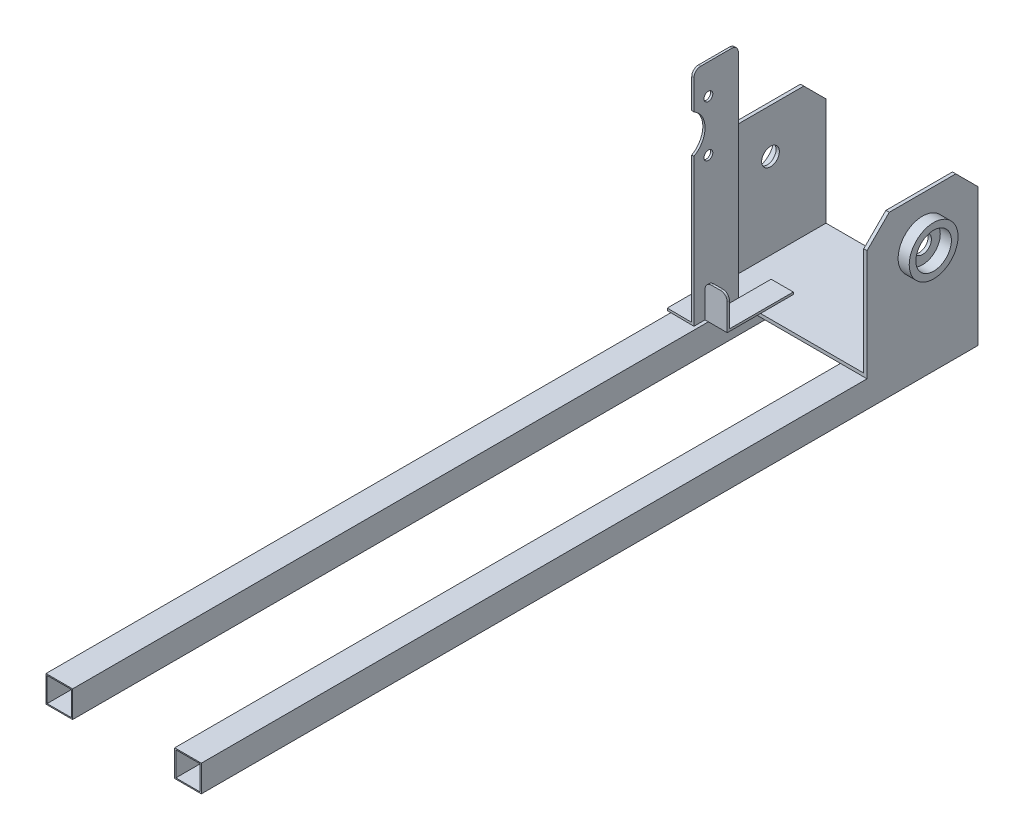
from build123d import *

# Parameters (mm, degrees)
BOSS_EXTRUDE1_DEPTH = 50
CHAMFER1_SIZE       = 10
SKETCH2_R           = 4
CUT_EXTRUDE1_DEPTH  = 80
SKETCH3_R           = 11
SKETCH3_R_2         = 8
BOSS_EXTRUDE2_DEPTH = 5
SKETCH4_W           = 12
SKETCH4_H           = 12
BOSS_EXTRUDE3_DEPTH = 350
SKETCH5_W           = 46
SKETCH5_H           = 12
BOSS_EXTRUDE4_DEPTH = 12
SKETCH9_W           = 11
SKETCH9_H           = 11
CUT_EXTRUDE3_DEPTH  = 380
BOSS_EXTRUDE5_DEPTH = 10
FILLET1_R           = 3
BOSS_EXTRUDE6_DEPTH = 20
FILLET2_R           = 3
SKETCH12_R          = 10
SKETCH12_R_2        = 2
CUT_EXTRUDE5_DEPTH  = 10


with BuildPart() as part:
    # Sketch1 → Boss-Extrude1 (new body)
    with BuildSketch(Plane.XY):
        Polygon((-65.816488176, 13.044356197), (-65.816488176, -46.955643803), (4.183511824, -46.955643803), (4.183511824, 13.044356197), (2.683511824, 13.044356197), (2.683511824, -45.455643803), (-64.316488176, -45.455643803), (-64.316488176, 13.044356197), align=None)
    extrude(amount=BOSS_EXTRUDE1_DEPTH)

    # Chamfer1
    chamfer1_edges = [part.edges().sort_by_distance(p)[0] for p in [
        (-65.066488176, 13.044356197, 0),
        (3.433511824, 13.044356197, 50),
        (-65.066488176, 13.044356197, 50),
        (3.433511824, 13.044356197, 0),
    ]]
    chamfer(chamfer1_edges, length=CHAMFER1_SIZE)

    # Sketch2 → Cut-Extrude1 (cut)
    with BuildSketch(Plane(origin=(4.183511824, 0, 0), x_dir=(0, 0, -1), z_dir=(1, 0, 0))):
        with Locations((-25, -6.955643803)):
            Circle(SKETCH2_R)
    extrude(amount=-CUT_EXTRUDE1_DEPTH, mode=Mode.SUBTRACT)

    # Sketch3 → Boss-Extrude2 (add)
    with BuildSketch(Plane(origin=(4.183511824, 0, 0), x_dir=(0, 0, -1), z_dir=(1, 0, 0))):
        with Locations(Location((-25, -6.955643803, 0), (0, 0, 180))):
            Circle(SKETCH3_R)
        with Locations((-25, -6.955643803)):
            Circle(SKETCH3_R_2, mode=Mode.SUBTRACT)
    boss_extrude2 = extrude(amount=BOSS_EXTRUDE2_DEPTH)

    # Mirror1: Boss-Extrude2 across plane
    add(boss_extrude2.mirror(Plane.ZY.offset(30.816488176)))

    # Sketch4 → Boss-Extrude3 (add)
    with BuildSketch(Plane(origin=(0, 0, 0), x_dir=(-1, 0, 0), z_dir=(0, 0, -1))):
        with Locations((1.816488176, -52.955643803)):
            Rectangle(SKETCH4_W, SKETCH4_H)
    boss_extrude3 = extrude(amount=-BOSS_EXTRUDE3_DEPTH)

    # Mirror2: Boss-Extrude3 across plane
    add(boss_extrude3.mirror(Plane.ZY.offset(30.816488176)))

    # Sketch5 → Boss-Extrude4 (add)
    with BuildSketch(Plane(origin=(0, 0, 0), x_dir=(-1, 0, 0), z_dir=(0, 0, -1))):
        with Locations((30.816488176, -52.955643803)):
            Rectangle(SKETCH5_W, SKETCH5_H)
    extrude(amount=-BOSS_EXTRUDE4_DEPTH)

    # Sketch9 → Cut-Extrude3 (cut)
    with BuildSketch(Plane.XY.offset(350)):
        with Locations((-59.816488176, -52.955643803)):
            Rectangle(SKETCH9_W, SKETCH9_H)
    cut_extrude3 = extrude(amount=-CUT_EXTRUDE3_DEPTH, mode=Mode.SUBTRACT)

    # Mirror3: Cut-Extrude3 across plane
    add(cut_extrude3.mirror(Plane.ZY.offset(30.816488176)), mode=Mode.SUBTRACT)

    # Sketch10 → Boss-Extrude5 (add)
    with BuildSketch(Plane(origin=(-53.816488176, 0, 0), x_dir=(0, 0, -1), z_dir=(1, 0, 0))):
        Polygon((-35.237542048, -45.455643803), (-65, -45.455643803), (-65, -30.455643803), (-64, -30.455643803), (-64, -44.455643803), (-35.237542048, -44.455643803), align=None)
    extrude(amount=BOSS_EXTRUDE5_DEPTH)

    # Fillet1
    fillet1_edges = [part.edges().sort_by_distance(p)[0] for p in [
        (-53.816488176, -30.455643803, 64.5),
        (-43.816488176, -30.455643803, 64.5),
    ]]
    fillet(fillet1_edges, radius=FILLET1_R)

    # Sketch11 → Boss-Extrude6 (add)
    with BuildSketch(Plane.XY.offset(50)):
        Polygon((-65.816488176, -45.345911858), (-53.816488176, -45.455643803), (-53.816488176, 54.544356197), (-54.816488176, 54.544356197), (-54.816488176, -44.446457666), (-65.840689421, -44.345648745), align=None)
    extrude(amount=BOSS_EXTRUDE6_DEPTH)

    # Fillet2
    fillet2_edges = [part.edges().sort_by_distance(p)[0] for p in [
        (-54.316488176, 54.544356197, 50),
        (-54.316488176, 54.544356197, 70),
    ]]
    fillet(fillet2_edges, radius=FILLET2_R)

    # Sketch12 → Cut-Extrude5 (cut)
    with BuildSketch(Plane(origin=(-53.816488176, 0, 0), x_dir=(0, 0, -1), z_dir=(1, 0, 0))):
        with Locations((-75, 29.544356197)):
            Circle(SKETCH12_R)
        with Locations((-63.5, 41.044356197)):
            Circle(SKETCH12_R_2)
        with Locations((-63.5, 18.044356197)):
            Circle(SKETCH12_R_2)
    extrude(amount=-CUT_EXTRUDE5_DEPTH, mode=Mode.SUBTRACT)


solid = part.part
